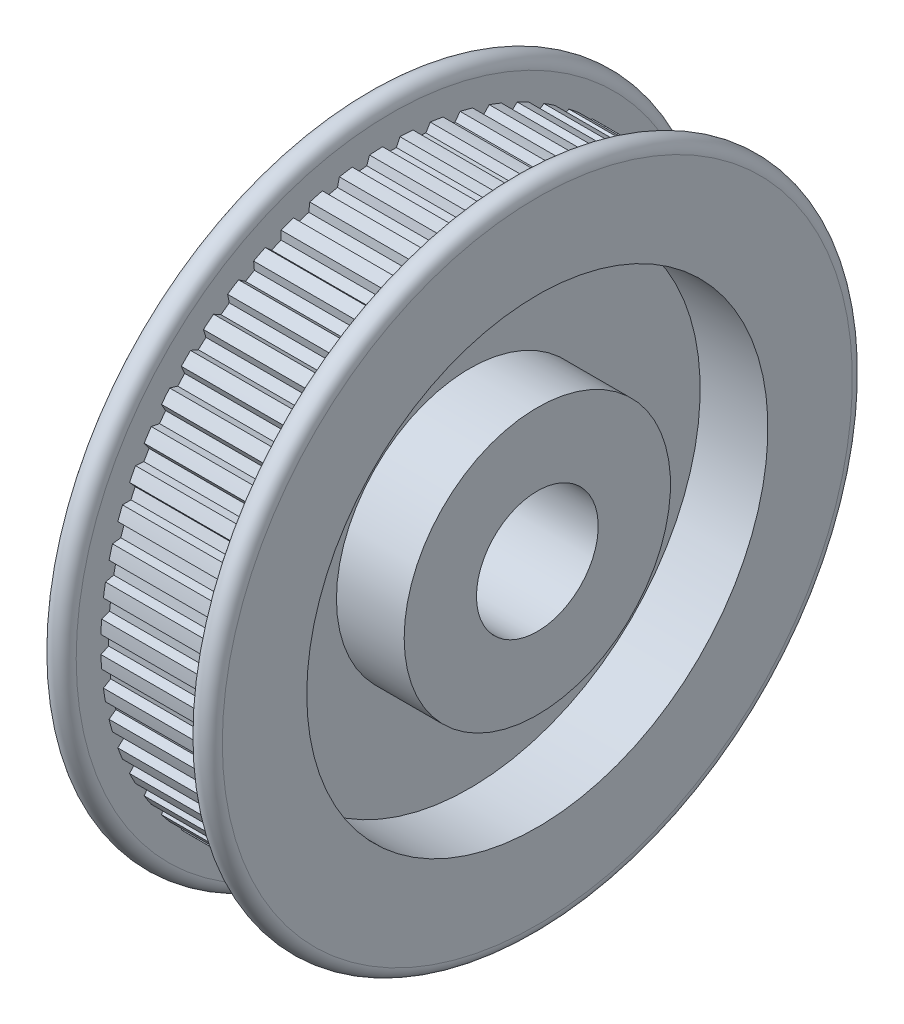
from build123d import *

# Parameters (mm, degrees)
SKETCH6_W          = 4.45
SKETCH6_H          = 6.4
SKETCH4_R          = 19.4
SKETCH4_R_2        = 19.0825
CUT_EXTRUDE2_DEPTH = 8
CUT_EXTRUDE1_DEPTH = 8
CIRPATTERN1_COUNT  = 60


with BuildPart() as part:
    # Sketch1 → Revolve1 (revolve)
    with BuildSketch(Plane.XY, mode=Mode.PRIVATE) as revolve1_sk:
        with BuildLine():
            Line((0, 19.15), (0, 20.7))
            ThreePointArc((0, 20.7), (-0.8, 21.5), (-1.6, 20.7))
            Line((-1.6, 20.7), (-1.6, 8.75))
            Line((-1.6, 8.75), (-7.9, 8.75))
            Line((-7.9, 8.75), (-7.9, 4))
            Line((-7.9, 4), (9.6, 4))
            Line((9.6, 4), (9.6, 11.49))
            Line((9.6, 11.49), (8, 11.49))
            Line((8, 11.49), (8, 19.15))
            Line((8, 19.15), (0, 19.15))
        make_face()
        with BuildLine():
            ThreePointArc((8, 20.7), (8.8, 21.5), (9.6, 20.7))
            Line((9.6, 20.7), (9.6, 11.49))
            Line((9.6, 11.49), (8, 11.49))
            Line((8, 11.49), (8, 19.15))
            Line((8, 19.15), (8, 20.7))
        make_face()
    revolve(revolve1_sk.sketch.rotate(Axis((-7.9, 0, 0), (1, 0, 0)), 90), axis=Axis((-7.9, 0, 0), (1, 0, 0)))

    # Sketch6 → Cut-Revolve1 (revolve, cut)
    with BuildSketch(Plane.XY, mode=Mode.PRIVATE) as cut_revolve1_sk:
        with Locations((0.625, 11.95)):
            Rectangle(SKETCH6_W, SKETCH6_H)
        with Locations((7.375, 11.95)):
            Rectangle(SKETCH6_W, SKETCH6_H)
    revolve(cut_revolve1_sk.sketch.rotate(Axis((-1.6, 0, 0), (1, 0, 0)), 90), axis=Axis((-1.6, 0, 0), (1, 0, 0)), mode=Mode.SUBTRACT)

    # Sketch4 → Cut-Extrude2 (cut)
    with BuildSketch(Plane(origin=(0, 0, 0), x_dir=(0, 0, -1), z_dir=(1, 0, 0))):
        Circle(SKETCH4_R)
        with Locations(Location((0, 0, 0), (0, 0, 180))):
            Circle(SKETCH4_R_2, mode=Mode.SUBTRACT)
    extrude(amount=CUT_EXTRUDE2_DEPTH, mode=Mode.SUBTRACT)

    # Sketch3 → Cut-Extrude1 (cut)
    with BuildSketch(Plane(origin=(0, 0, 0), x_dir=(0, 0, -1), z_dir=(1, 0, 0))):
        with BuildLine():
            Line((-0.644483371, 19.230453524), (-0.337180019, 18.57143936))
            Line((-0.337180019, 18.57143936), (0.337180019, 18.57143936))
            Line((0.337180019, 18.57143936), (0.644483371, 19.230453524))
            ThreePointArc((0.644483371, 19.230453524), (0, 19.24125), (-0.644483371, 19.230453524))
        make_face()
    cut_extrude1 = extrude(amount=CUT_EXTRUDE1_DEPTH, mode=Mode.SUBTRACT)

    # CirPattern1: Cut-Extrude1 ×60 about axis
    cirpattern1_axis = Axis((0, 0, 0), (1, 0, 0))
    for i in range(1, CIRPATTERN1_COUNT):
        add(cut_extrude1.rotate(cirpattern1_axis, i * 360 / CIRPATTERN1_COUNT), mode=Mode.SUBTRACT)


solid = part.part
